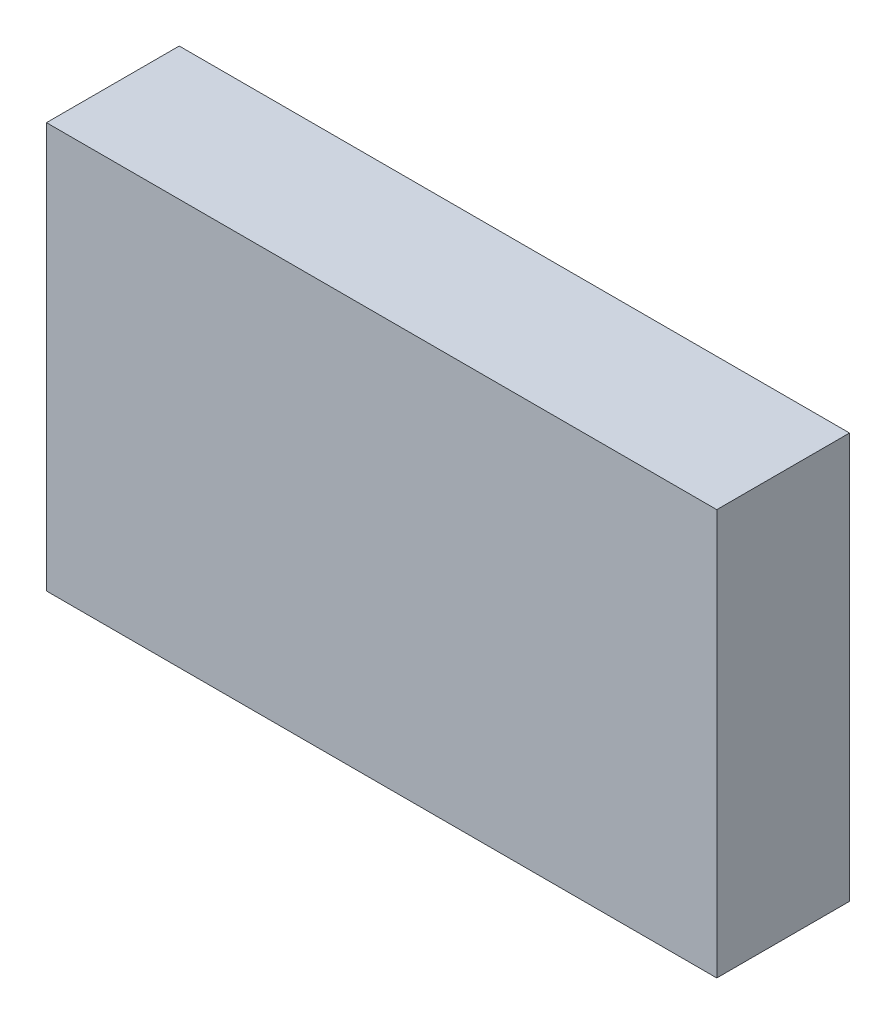
from build123d import *

# Parameters (mm, degrees)
SKETCH1_W           = 81.8
SKETCH1_H           = 49.5
BOSS_EXTRUDE1_DEPTH = 16.2


with BuildPart() as part:
    # Sketch1 → Boss-Extrude1 (new body)
    with BuildSketch(Plane.XY):
        with Locations((40.9, 24.75)):
            Rectangle(SKETCH1_W, SKETCH1_H)
    extrude(amount=BOSS_EXTRUDE1_DEPTH)


solid = part.part
